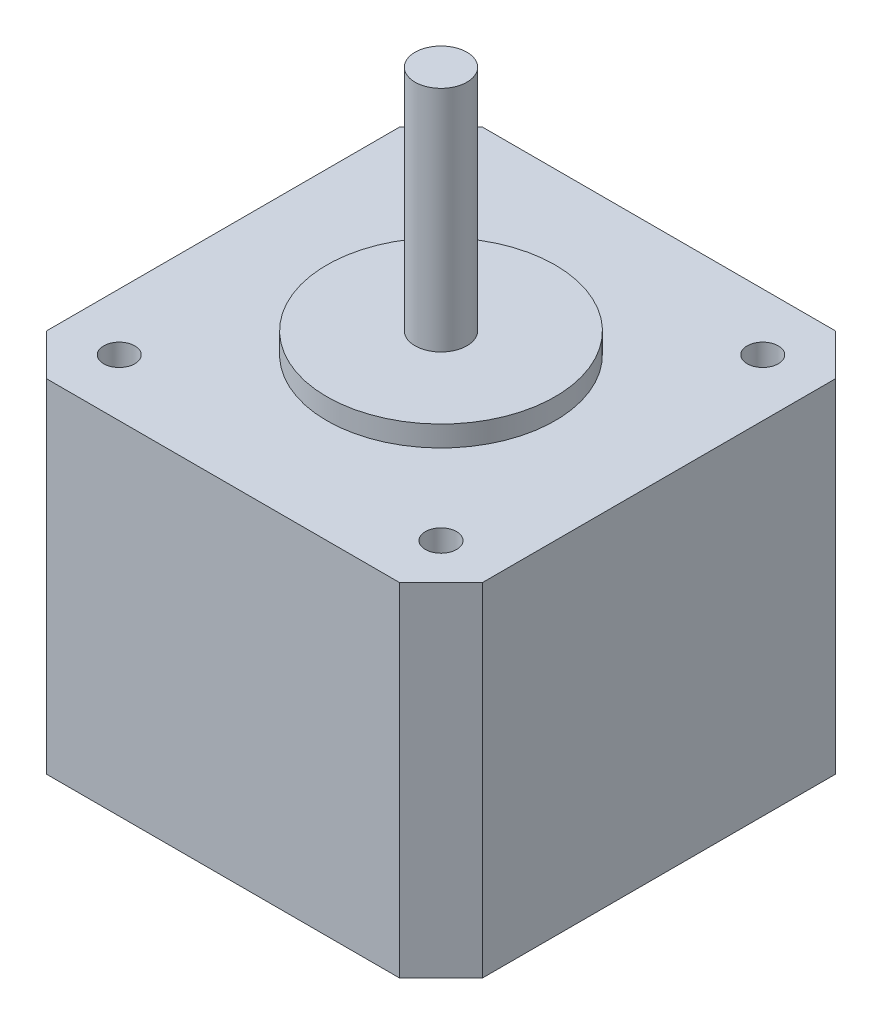
from build123d import *

# Parameters (mm, degrees)
SKETCH1_W           = 42
SKETCH1_H           = 42
SKETCH1_R           = 1.5
BOSS_EXTRUDE1_DEPTH = 33
CHAMFER1_SIZE       = 4
SKETCH2_R           = 11
BOSS_EXTRUDE2_DEPTH = 2
SKETCH3_R           = 2.5
BOSS_EXTRUDE3_DEPTH = 22


with BuildPart() as part:
    # Sketch1 → Boss-Extrude1 (new body)
    with BuildSketch(Plane(origin=(0, 0, 0), x_dir=(1, 0, 0), z_dir=(0, 1, 0))):
        Rectangle(SKETCH1_W, SKETCH1_H)
        with Locations(Location((15.5, 15.5, 0), (0, 0, 270))):
            Circle(SKETCH1_R, mode=Mode.SUBTRACT)
        with Locations(Location((-15.5, 15.5, 0), (0, 0, 270))):
            Circle(SKETCH1_R, mode=Mode.SUBTRACT)
        with Locations(Location((15.5, -15.5, 0), (0, 0, 90))):
            Circle(SKETCH1_R, mode=Mode.SUBTRACT)
        with Locations(Location((-15.5, -15.5, 0), (0, 0, 90))):
            Circle(SKETCH1_R, mode=Mode.SUBTRACT)
    extrude(amount=BOSS_EXTRUDE1_DEPTH)

    # Chamfer1
    chamfer1_edges = [part.edges().sort_by_distance(p)[0] for p in [
        (21, 16.5, 21),
        (-21, 16.5, 21),
        (-21, 16.5, -21),
        (21, 16.5, -21),
    ]]
    chamfer(chamfer1_edges, length=CHAMFER1_SIZE)

    # Sketch2 → Boss-Extrude2 (add)
    with BuildSketch(Plane(origin=(0, 33, 0), x_dir=(1, 0, 0), z_dir=(0, 1, 0))):
        with Locations(Location((0, 0, 0), (0, 0, 270))):
            Circle(SKETCH2_R)
    extrude(amount=BOSS_EXTRUDE2_DEPTH)

    # Sketch3 → Boss-Extrude3 (add)
    with BuildSketch(Plane(origin=(0, 35, 0), x_dir=(1, 0, 0), z_dir=(0, 1, 0))):
        with Locations(Location((0, 0, 0), (0, 0, 270))):
            Circle(SKETCH3_R)
    extrude(amount=BOSS_EXTRUDE3_DEPTH)


solid = part.part
